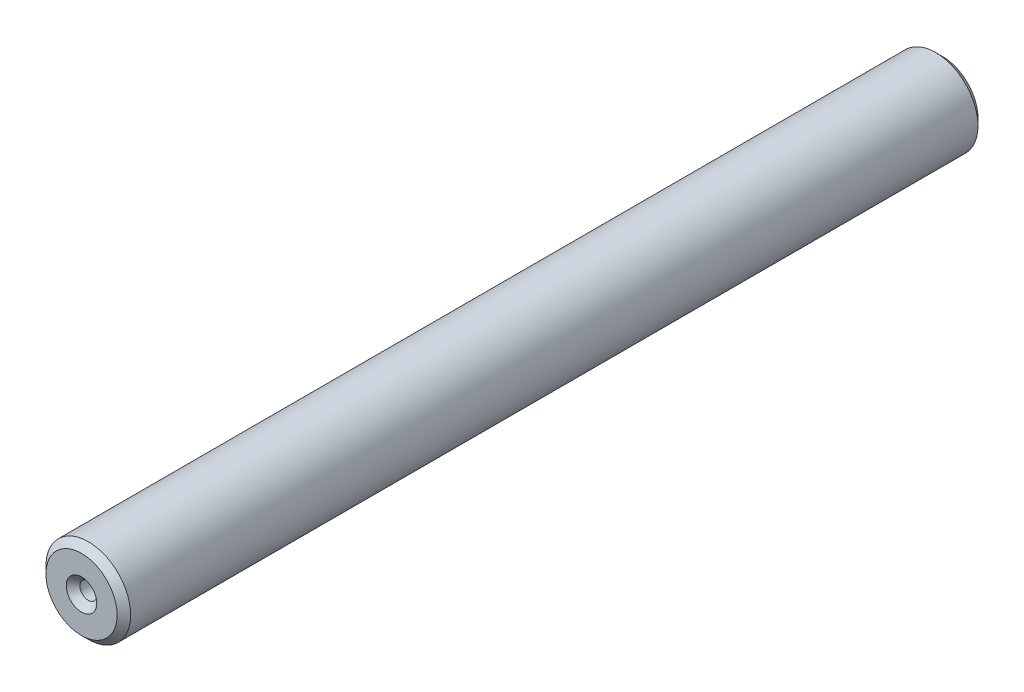
from build123d import *

# Parameters (mm, degrees)
SKETCH1_R           = 12.5
SKETCH1_R_2         = 2.5
BOSS_EXTRUDE1_DEPTH = 127
CHAMFER1_SIZE       = 2


with BuildPart() as part:
    # Sketch1 → Boss-Extrude1 (new, symmetric)
    with BuildSketch(Plane.XY):
        Circle(SKETCH1_R)
        Circle(SKETCH1_R_2, mode=Mode.SUBTRACT)
    extrude(amount=BOSS_EXTRUDE1_DEPTH, both=True)

    # Chamfer1
    chamfer1_edges = [part.edges().sort_by_distance(p)[0] for p in [
        (-12.5, 0, -127),
        (-12.5, 0, 127),
        (-2.5, 0, -127),
        (-2.5, 0, 127),
    ]]
    chamfer(chamfer1_edges, length=CHAMFER1_SIZE)


solid = part.part
